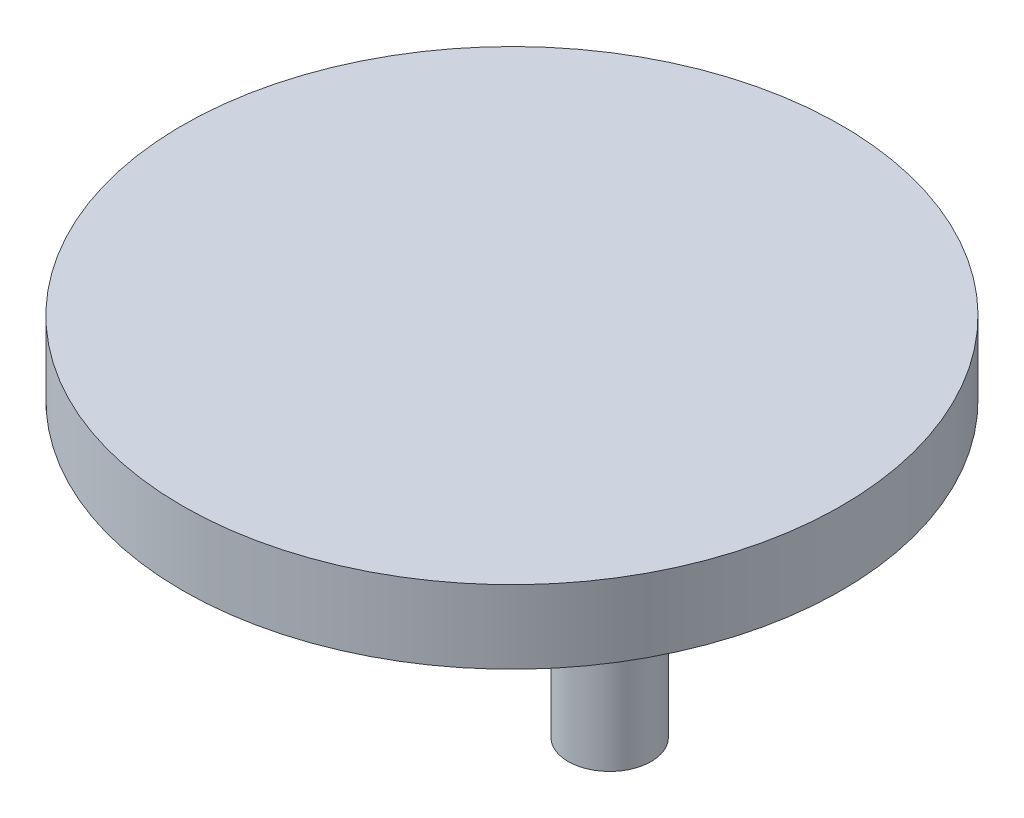
from build123d import *

# Parameters (mm, degrees)
SKETCH2_R           = 27
BOSS_EXTRUDE1_DEPTH = 6
SKETCH1_R           = 3.4
BOSS_EXTRUDE2_DEPTH = 9
CHAMFER1_SIZE       = 1


with BuildPart() as part:
    # Sketch2 → Boss-Extrude1 (new body)
    with BuildSketch(Plane(origin=(0, 0, 0), x_dir=(1, 0, 0), z_dir=(0, 1, 0))):
        with Locations(Location((0, 0, 0), (0, 0, 270))):
            Circle(SKETCH2_R)
    extrude(amount=BOSS_EXTRUDE1_DEPTH)

    # Sketch1 → Boss-Extrude2 (add)
    with BuildSketch(Plane(origin=(0, 0, 0), x_dir=(1, 0, 0), z_dir=(0, 1, 0))):
        with Locations(Location((0, 21.875, 0), (0, 0, 270))):
            Circle(SKETCH1_R)
        with Locations(Location((18.944305708, -10.9375, 0), (0, 0, 270))):
            Circle(SKETCH1_R)
        with Locations(Location((-18.944305708, -10.9375, 0), (0, 0, 270))):
            Circle(SKETCH1_R)
    extrude(amount=-BOSS_EXTRUDE2_DEPTH)

    # Chamfer1
    chamfer1_edges = [part.edges().sort_by_distance(p)[0] for p in [
        (-18.944305708, 0, 7.5375),
        (18.944305708, 0, 7.5375),
        (0, 0, -25.275),
    ]]
    chamfer(chamfer1_edges, length=CHAMFER1_SIZE)


solid = part.part
